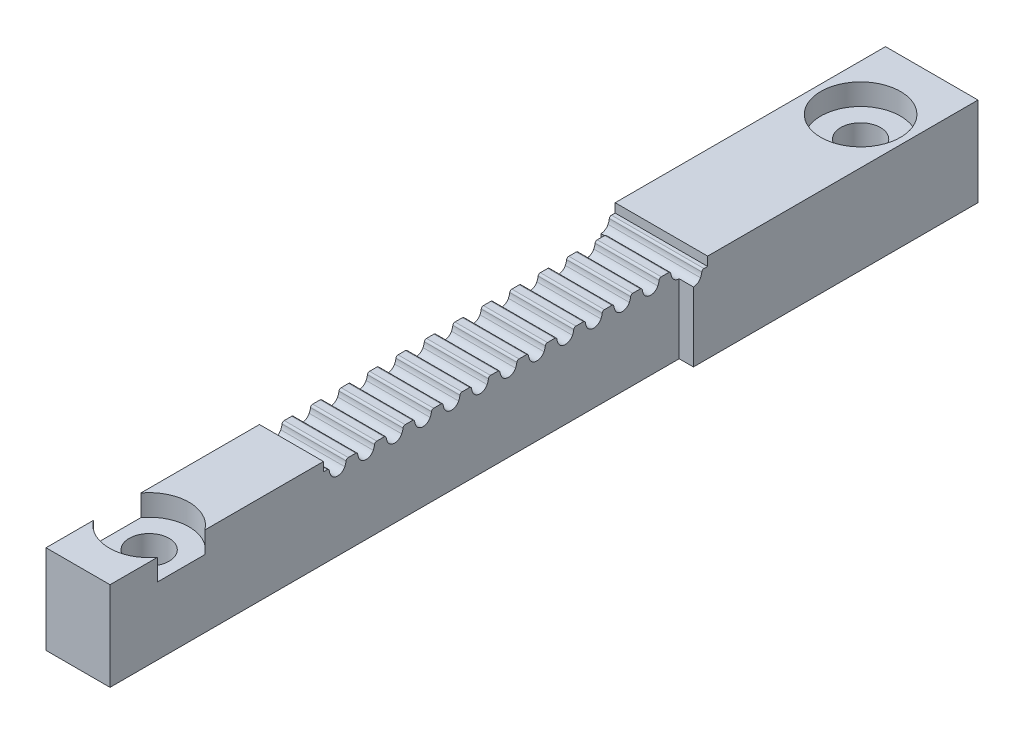
from build123d import *

# Parameters (mm, degrees)
SKETCH1_W                        = 6.5
SKETCH1_H                        = 60
BOSS_EXTRUDE1_DEPTH              = 6.25
CUT_EXTRUDE3_DEPTH               = 61.673820549
LPATTERN1_COUNT                  = 12
LPATTERN1_PITCH                  = 2
CBORE_FOR_M1_6_SHCS1_D           = 2.8
CBORE_FOR_M1_6_SHCS1_CBORE_D     = 5.6
CBORE_FOR_M1_6_SHCS1_CBORE_DEPTH = 1.5
SKETCH6_W                        = 1
SKETCH6_H                        = 40
CUT_EXTRUDE2_DEPTH               = 61.673820549


with BuildPart() as part:
    # Sketch1 → Boss-Extrude1 (new body)
    with BuildSketch(Plane(origin=(0, 0, 0), x_dir=(1, 0, 0), z_dir=(0, 1, 0))):
        with Locations((3.25, 30)):
            Rectangle(SKETCH1_W, SKETCH1_H)
    extrude(amount=BOSS_EXTRUDE1_DEPTH)

    # Sketch9 → Cut-Extrude3 (cut, through all)
    with BuildSketch(Plane.ZY):
        with BuildLine():
            Line((-19, 6.25), (-15, 6.25))
            Line((-15, 6.25), (-15, 5.62))
            Line((-15, 5.62), (-15.259824575, 5.62))
            ThreePointArc((-15.259824575, 5.62), (-15.358731646, 5.582771412), (-15.408543109, 5.489565217))
            ThreePointArc((-15.408543109, 5.489565217), (-15.442388286, 5.331937846), (-15.501123596, 5.181797753))
            ThreePointArc((-15.501123596, 5.181797753), (-16, 4.87), (-16.498876404, 5.181797753))
            ThreePointArc((-16.498876404, 5.181797753), (-16.557611714, 5.331937846), (-16.591456891, 5.489565217))
            ThreePointArc((-16.591456891, 5.489565217), (-16.641268354, 5.582771412), (-16.740175425, 5.62))
            Line((-16.740175425, 5.62), (-17.259824575, 5.62))
            ThreePointArc((-17.259824575, 5.62), (-17.358731646, 5.582771412), (-17.408543109, 5.489565217))
            ThreePointArc((-17.408543109, 5.489565217), (-17.442388286, 5.331937846), (-17.501123596, 5.181797753))
            ThreePointArc((-17.501123596, 5.181797753), (-18, 4.87), (-18.498876404, 5.181797753))
            ThreePointArc((-18.498876404, 5.181797753), (-18.557611714, 5.331937846), (-18.591456891, 5.489565217))
            ThreePointArc((-18.591456891, 5.489565217), (-18.641268354, 5.582771412), (-18.740175425, 5.62))
            Line((-18.740175425, 5.62), (-19, 5.62))
            Line((-19, 5.62), (-19, 6.25))
        make_face()
    cut_extrude3 = extrude(amount=-CUT_EXTRUDE3_DEPTH, mode=Mode.SUBTRACT)

    # LPattern1: Cut-Extrude3 ×12
    with Locations(*[(0, 0, -i * LPATTERN1_PITCH) for i in range(1, LPATTERN1_COUNT)]):
        add(cut_extrude3, mode=Mode.SUBTRACT)

    # CBORE for M1.6 SHCS1 (through all)
    with Locations(Plane(origin=(0, 6.25, 0), x_dir=(1, 0, 0), z_dir=(0, 1, 0))):
        with Locations((3.25, 55), (3.25, 5)):
            CounterBoreHole(CBORE_FOR_M1_6_SHCS1_D / 2, CBORE_FOR_M1_6_SHCS1_CBORE_D / 2, CBORE_FOR_M1_6_SHCS1_CBORE_DEPTH)

    # Sketch6 → Cut-Extrude2 (cut, through all)
    with BuildSketch(Plane(origin=(0, 6.25, 0), x_dir=(1, 0, 0), z_dir=(0, 1, 0))):
        with Locations((6, 20)):
            Rectangle(SKETCH6_W, SKETCH6_H)
        with Locations((0.5, 20)):
            Rectangle(SKETCH6_W, SKETCH6_H)
    extrude(amount=-CUT_EXTRUDE2_DEPTH, mode=Mode.SUBTRACT)


solid = part.part
